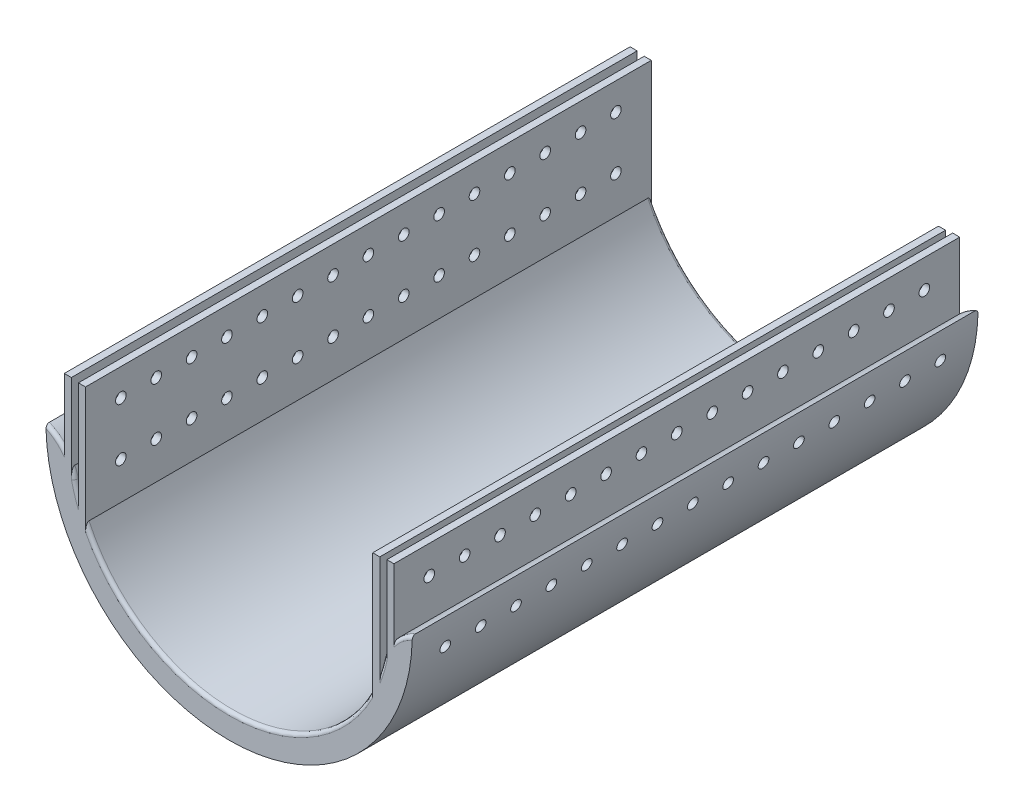
from build123d import *

# Parameters (mm, degrees)
BOSS_EXTRUDE1_DEPTH     = 160
FILLET1_R               = 1
SKETCH2_W               = 2
SKETCH2_H               = 25
SKETCH2_H_2             = 35.546133209
BOSS_EXTRUDE2_DEPTH     = 160
CUT_EXTRUDE1_DEPTH      = 195.852611567
CUT_EXTRUDE1_DEPTH_BACK = 195.852611567
SKETCH3_R               = 1.5


with BuildPart() as part:
    # Sketch1 → Boss-Extrude1 (new body)
    with BuildSketch(Plane.XY):
        with BuildLine():
            ThreePointArc((51.799134905, -0.299371122), (46.547785493, -4.192513279), (43.635194663, -10.04486675))
            ThreePointArc((43.635194663, -10.04486675), (0, -44.776439802), (-43.635194663, -10.04486675))
            ThreePointArc((-43.635194663, -10.04486675), (-46.547785493, -4.192513279), (-51.799134905, -0.299371122))
            ThreePointArc((-51.799134905, -0.299371122), (0, -51.8), (51.799134905, -0.299371122))
        make_face()
    extrude(amount=BOSS_EXTRUDE1_DEPTH)

    # Fillet1
    fillet1_edges = [part.edges().sort_by_distance(p)[0] for p in [
        (0, -44.776439802, 160),
        (-46.547785493, -4.192513279, 160),
        (-46.547785493, -4.192513279, 0),
        (0, -44.776439802, 0),
        (46.547785493, -4.192513279, 0),
        (46.547785493, -4.192513279, 160),
    ]]
    fillet(fillet1_edges, radius=FILLET1_R)

    # Sketch2 → Boss-Extrude2 (add)
    with BuildSketch(Plane.XY.offset(160)):
        with Locations((-45.609707037, 2.230799497)):
            Rectangle(SKETCH2_W, SKETCH2_H)
        with Locations((45.609707037, 2.230799497)):
            Rectangle(SKETCH2_W, SKETCH2_H)
        with Locations((41.609707037, -3.353554877)):
            Rectangle(SKETCH2_W, SKETCH2_H_2)
        with Locations((-41.609707037, -3.353554877)):
            Rectangle(SKETCH2_W, SKETCH2_H_2)
    extrude(amount=-BOSS_EXTRUDE2_DEPTH)

    # Sketch3 → Cut-Extrude1 (cut, two sides: drawn at the far end of the back side and taken through both)
    with BuildSketch(Plane(origin=(46.609707037, 0, 0), x_dir=(0, 0, -1), z_dir=(1, 0, 0)).offset(-CUT_EXTRUDE1_DEPTH_BACK)):
        with Locations((-150, 6.730799497)):
            Circle(SKETCH3_R)
        with Locations((-150, -8.269200503)):
            Circle(SKETCH3_R)
        with Locations((-140, 6.730799497)):
            Circle(SKETCH3_R)
        with Locations((-140, -8.269200503)):
            Circle(SKETCH3_R)
        with Locations((-130, 6.730799497)):
            Circle(SKETCH3_R)
        with Locations((-130, -8.269200503)):
            Circle(SKETCH3_R)
        with Locations((-120, 6.730799497)):
            Circle(SKETCH3_R)
        with Locations((-120, -8.269200503)):
            Circle(SKETCH3_R)
        with Locations((-110, 6.730799497)):
            Circle(SKETCH3_R)
        with Locations((-110, -8.269200503)):
            Circle(SKETCH3_R)
        with Locations((-100, 6.730799497)):
            Circle(SKETCH3_R)
        with Locations((-100, -8.269200503)):
            Circle(SKETCH3_R)
        with Locations((-90, 6.730799497)):
            Circle(SKETCH3_R)
        with Locations((-90, -8.269200503)):
            Circle(SKETCH3_R)
        with Locations((-80, 6.730799497)):
            Circle(SKETCH3_R)
        with Locations((-80, -8.269200503)):
            Circle(SKETCH3_R)
        with Locations((-70, 6.730799497)):
            Circle(SKETCH3_R)
        with Locations((-70, -8.269200503)):
            Circle(SKETCH3_R)
        with Locations((-60, 6.730799497)):
            Circle(SKETCH3_R)
        with Locations((-60, -8.269200503)):
            Circle(SKETCH3_R)
        with Locations((-50, 6.730799497)):
            Circle(SKETCH3_R)
        with Locations((-50, -8.269200503)):
            Circle(SKETCH3_R)
        with Locations((-40, 6.730799497)):
            Circle(SKETCH3_R)
        with Locations((-40, -8.269200503)):
            Circle(SKETCH3_R)
        with Locations((-30, 6.730799497)):
            Circle(SKETCH3_R)
        with Locations((-30, -8.269200503)):
            Circle(SKETCH3_R)
        with Locations((-20, 6.730799497)):
            Circle(SKETCH3_R)
        with Locations((-20, -8.269200503)):
            Circle(SKETCH3_R)
        with Locations((-10, 6.730799497)):
            Circle(SKETCH3_R)
        with Locations((-10, -8.269200503)):
            Circle(SKETCH3_R)
    extrude(amount=CUT_EXTRUDE1_DEPTH + CUT_EXTRUDE1_DEPTH_BACK, mode=Mode.SUBTRACT)


solid = part.part
